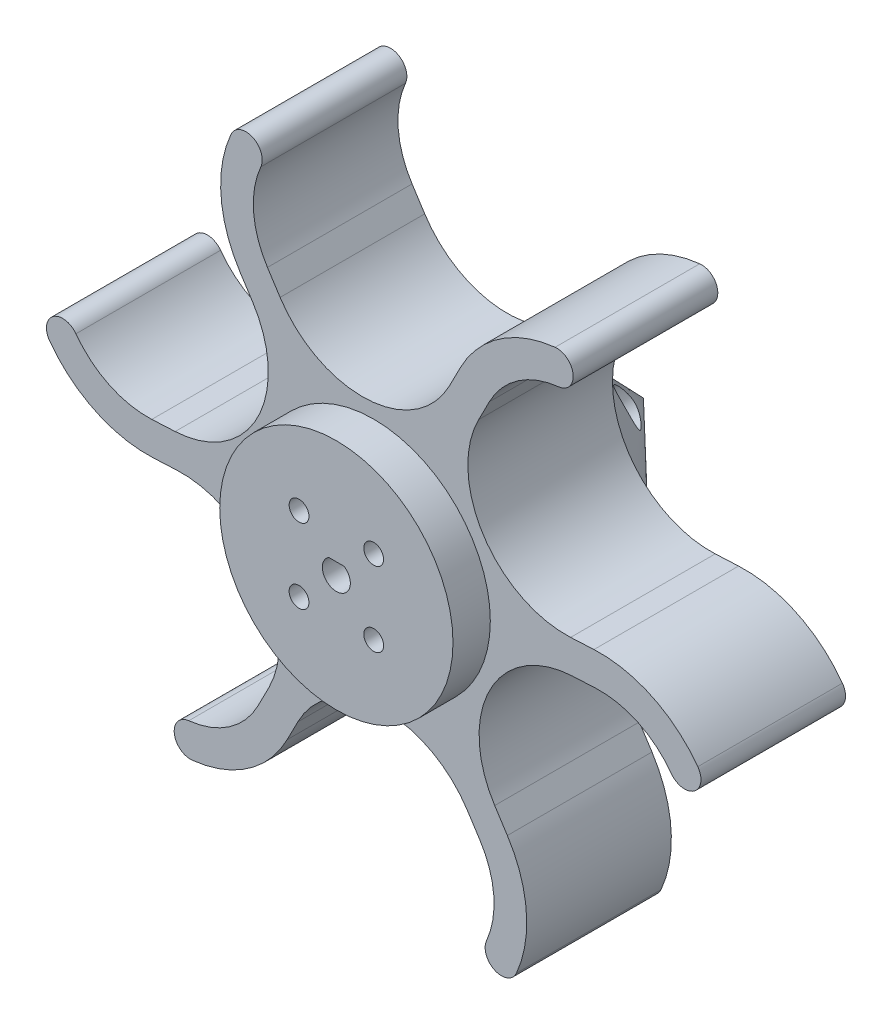
from build123d import *

# Parameters (mm, degrees)
SKETCH1_R                      = 3.5
BOSS_EXTRUDE1_DEPTH            = 21
SKETCH4_R                      = 25
BOSS_EXTRUDE2_DEPTH            = 18
CUT_EXTRUDE2_DEPTH             = 20
SKETCH7_R                      = 2.125
CUT_EXTRUDE3_DEPTH             = 105.070425208
SKETCH9_R                      = 4
CUT_EXTRUDE4_DEPTH             = 36
CUT_EXTRUDE4_DIRECTION_2_REACH = 91.556
SKETCH10_R                     = 2.125
BOSS_EXTRUDE3_DEPTH            = 10
BOSS_EXTRUDE4_DEPTH            = 31
CUT_EXTRUDE5_DEPTH             = 31
CIRPATTERN1_COUNT              = 6


with BuildPart() as part:
    # Sketch1 → Boss-Extrude1 (new body)
    with BuildSketch(Plane.XY):
        with BuildLine():
            ThreePointArc((-27.16441994, 47.550254291), (-29.67571676, 44.192804958), (-33.605829095, 45.653385243))
            Line((-33.605829095, 45.653385243), (-25.93972411, 33.765821671))
            ThreePointArc((-25.93972411, 33.765821671), (-24.90753088, 12.791204222), (-42.555985811, 1.409989939))
            Line((-42.555985811, 1.409989939), (-56.683970347, 0.71473006))
            ThreePointArc((-56.683970347, 0.71473006), (-54.098653318, -0.246072778), (-53.011938142, -2.781039515))
            ThreePointArc((-53.011938142, -2.781039515), (-53.976971405, -5.194324339), (-56.339905937, -6.27680909))
            Line((-56.339905937, -6.27680909), (-42.211921401, -5.581549211))
            ThreePointArc((-42.211921401, -5.581549211), (-23.531273241, -15.174952377), (-22.499080012, -36.149569826))
            Line((-22.499080012, -36.149569826), (-28.960959562, -48.732393278))
            ThreePointArc((-28.960959562, -48.732393278), (-25.025035607, -46.929305801), (-22.347518202, -50.331293805))
            ThreePointArc((-22.347518202, -50.331293805), (-22.445530198, -51.153776401), (-22.734076842, -51.930194333))
            Line((-22.734076842, -51.930194333), (-16.272197292, -39.347370882))
            ThreePointArc((-16.272197292, -39.347370882), (1.376257639, -27.966156599), (20.0569058, -37.559559765))
            Line((20.0569058, -37.559559765), (27.723010785, -49.447123338))
            ThreePointArc((27.723010785, -49.447123338), (28.767550893, -44.608845135), (33.605829095, -45.653385243))
            Line((33.605829095, -45.653385243), (25.93972411, -33.765821671))
            ThreePointArc((25.93972411, -33.765821671), (24.90753088, -12.791204222), (42.555985811, -1.409989939))
            Line((42.555985811, -1.409989939), (56.683970347, -0.71473006))
            ThreePointArc((56.683970347, -0.71473006), (53.016168567, 2.60900731), (56.339905937, 6.27680909))
            Line((56.339905937, 6.27680909), (42.211921401, 5.581549211))
            ThreePointArc((42.211921401, 5.581549211), (23.531273241, 15.174952377), (22.499080012, 36.149569826))
            Line((22.499080012, 36.149569826), (28.960959562, 48.732393278))
            ThreePointArc((28.960959562, 48.732393278), (24.248617674, 47.217852445), (22.734076842, 51.930194333))
            Line((22.734076842, 51.930194333), (16.272197292, 39.347370882))
            ThreePointArc((16.272197292, 39.347370882), (-1.376257639, 27.966156599), (-20.0569058, 37.559559765))
            Line((-20.0569058, 37.559559765), (-27.723010785, 49.447123338))
            ThreePointArc((-27.723010785, 49.447123338), (-27.306970607, 48.538957471), (-27.16441994, 47.550254291))
        make_face()
        with Locations((-56.511938142, -2.781039515)):
            Circle(SKETCH1_R)
        with Locations((-30.66441994, 47.550254291)):
            Circle(SKETCH1_R)
        with Locations((25.847518202, 50.331293805)):
            Circle(SKETCH1_R)
        with Locations((56.511938142, 2.781039515)):
            Circle(SKETCH1_R)
        with Locations((30.66441994, -47.550254291)):
            Circle(SKETCH1_R)
        with Locations((-25.847518202, -50.331293805)):
            Circle(SKETCH1_R)
    extrude(amount=BOSS_EXTRUDE1_DEPTH)

    # Sketch3 → Revolve1 (revolve)
    with BuildSketch(Plane(origin=(0, 0, 0), x_dir=(-0.9987913071010414, -0.04915205854685543, 0), z_dir=(0.04915205854685543, -0.9987913071010414, 0)), mode=Mode.PRIVATE) as revolve1_sk:
        Polygon((0, 0), (-28, 0), (0, 26.813467396), align=None)
    revolve(revolve1_sk.sketch.rotate(Axis((0, 0, -26.813467396), (0, 0, 1)), 357.182659299), axis=Axis((0, 0, -26.813467396), (0, 0, 1)))

    # Sketch4 → Boss-Extrude2 (add)
    with BuildSketch(Plane.XY.offset(21)):
        Circle(SKETCH4_R)
    extrude(amount=BOSS_EXTRUDE2_DEPTH)

    # Sketch5 → Cut-Extrude2 (cut)
    with BuildSketch(Plane.XY.offset(39)):
        with BuildLine():
            Line((-1.658312395, 2.5), (1.658312395, 2.5))
            ThreePointArc((1.658312395, 2.5), (0, -3), (-1.658312395, 2.5))
        make_face()
    extrude(amount=-CUT_EXTRUDE2_DEPTH, mode=Mode.SUBTRACT)

    # Sketch7 → Cut-Extrude3 (cut, through all)
    with BuildSketch(Plane.XY.offset(39)):
        with Locations((-8, 8)):
            Circle(SKETCH7_R)
        with Locations(Location((8, 8, 0), (0, 0, 225))):
            Circle(SKETCH7_R)
        with Locations((8, -8)):
            Circle(SKETCH7_R)
        with Locations(Location((-8, -8, 0), (0, 0, 110.081495148))):
            Circle(SKETCH7_R)
    extrude(amount=-CUT_EXTRUDE3_DEPTH, mode=Mode.SUBTRACT)

    # Sketch9 → Cut-Extrude4 (cut)
    with BuildSketch(Plane(origin=(0, 0, 0), x_dir=(-1, 0, 0), z_dir=(0, 0, -1))):
        with Locations(Location((-8, 8, 0), (0, 0, 315))):
            Circle(SKETCH9_R)
        with Locations(Location((8, 8, 0), (0, 0, 225))):
            Circle(SKETCH9_R)
        with Locations(Location((8, -8, 0), (0, 0, 135))):
            Circle(SKETCH9_R)
        with Locations(Location((-8, -8, 0), (0, 0, 45))):
            Circle(SKETCH9_R)
    extrude(amount=-CUT_EXTRUDE4_DEPTH, mode=Mode.SUBTRACT)

    # Cut-Extrude4 direction 2: up to this cone (the profile starts inside it)
    cut_extrude4_direction_2_end = Plane(origin=(0, 0, 0), z_dir=(0, 0, 1)).offset(-26.813466396) * Cone(1.044e-06, 153.368642194, 146.869466396, align=(Align.CENTER, Align.CENTER, Align.MIN), mode=Mode.PRIVATE)
    # Sketch9 → Cut-Extrude4 direction 2 (cut, up to the surface)
    with BuildSketch(Plane(origin=(0, 0, 0), x_dir=(-1, 0, 0), z_dir=(0, 0, -1)), mode=Mode.PRIVATE) as cut_extrude4_direction_2_sk1:
        with Locations(Location((-8, 8, 0), (0, 0, 315))):
            Circle(SKETCH9_R)
    cut_extrude4_direction_2_tool1 = extrude(cut_extrude4_direction_2_sk1.sketch, amount=CUT_EXTRUDE4_DIRECTION_2_REACH, mode=Mode.PRIVATE) & cut_extrude4_direction_2_end
    add(cut_extrude4_direction_2_tool1.solids().sort_by_distance((8, 8, 0))[0], mode=Mode.SUBTRACT)
    # Sketch9 → Cut-Extrude4 direction 2 (cut, up to the surface)
    with BuildSketch(Plane(origin=(0, 0, 0), x_dir=(-1, 0, 0), z_dir=(0, 0, -1)), mode=Mode.PRIVATE) as cut_extrude4_direction_2_sk2:
        with Locations(Location((8, 8, 0), (0, 0, 225))):
            Circle(SKETCH9_R)
    cut_extrude4_direction_2_tool2 = extrude(cut_extrude4_direction_2_sk2.sketch, amount=CUT_EXTRUDE4_DIRECTION_2_REACH, mode=Mode.PRIVATE) & cut_extrude4_direction_2_end
    add(cut_extrude4_direction_2_tool2.solids().sort_by_distance((-8, 8, 0))[0], mode=Mode.SUBTRACT)
    # Sketch9 → Cut-Extrude4 direction 2 (cut, up to the surface)
    with BuildSketch(Plane(origin=(0, 0, 0), x_dir=(-1, 0, 0), z_dir=(0, 0, -1)), mode=Mode.PRIVATE) as cut_extrude4_direction_2_sk3:
        with Locations(Location((8, -8, 0), (0, 0, 135))):
            Circle(SKETCH9_R)
    cut_extrude4_direction_2_tool3 = extrude(cut_extrude4_direction_2_sk3.sketch, amount=CUT_EXTRUDE4_DIRECTION_2_REACH, mode=Mode.PRIVATE) & cut_extrude4_direction_2_end
    add(cut_extrude4_direction_2_tool3.solids().sort_by_distance((-8, -8, 0))[0], mode=Mode.SUBTRACT)
    # Sketch9 → Cut-Extrude4 direction 2 (cut, up to the surface)
    with BuildSketch(Plane(origin=(0, 0, 0), x_dir=(-1, 0, 0), z_dir=(0, 0, -1)), mode=Mode.PRIVATE) as cut_extrude4_direction_2_sk4:
        with Locations(Location((-8, -8, 0), (0, 0, 45))):
            Circle(SKETCH9_R)
    cut_extrude4_direction_2_tool4 = extrude(cut_extrude4_direction_2_sk4.sketch, amount=CUT_EXTRUDE4_DIRECTION_2_REACH, mode=Mode.PRIVATE) & cut_extrude4_direction_2_end
    add(cut_extrude4_direction_2_tool4.solids().sort_by_distance((8, -8, 0))[0], mode=Mode.SUBTRACT)

    # Sketch10 → Boss-Extrude3 (add)
    with BuildSketch(Plane.XY.offset(21)):
        with BuildLine():
            Line((-22.499080012, -36.149569826), (-28.960959562, -48.732393278))
            ThreePointArc((-28.960959562, -48.732393278), (-27.44641873, -53.444735165), (-22.734076842, -51.930194333))
            Line((-22.734076842, -51.930194333), (-16.272197292, -39.347370882))
            ThreePointArc((-16.272197292, -39.347370882), (1.376257639, -27.966156599), (20.0569058, -37.559559765))
            Line((20.0569058, -37.559559765), (27.723010785, -49.447123338))
            ThreePointArc((27.723010785, -49.447123338), (32.561288987, -50.491663446), (33.605829095, -45.653385243))
            Line((33.605829095, -45.653385243), (25.93972411, -33.765821671))
            ThreePointArc((25.93972411, -33.765821671), (24.90753088, -12.791204222), (42.555985811, -1.409989939))
            Line((42.555985811, -1.409989939), (56.683970347, -0.71473006))
            ThreePointArc((56.683970347, -0.71473006), (60.007707717, 2.95307172), (56.339905937, 6.27680909))
            Line((56.339905937, 6.27680909), (42.211921401, 5.581549211))
            ThreePointArc((42.211921401, 5.581549211), (23.531273241, 15.174952377), (22.499080012, 36.149569826))
            Line((22.499080012, 36.149569826), (28.960959562, 48.732393278))
            ThreePointArc((28.960959562, 48.732393278), (27.44641873, 53.444735165), (22.734076842, 51.930194333))
            Line((22.734076842, 51.930194333), (16.272197292, 39.347370882))
            ThreePointArc((16.272197292, 39.347370882), (-1.376257639, 27.966156599), (-20.0569058, 37.559559765))
            Line((-20.0569058, 37.559559765), (-27.723010785, 49.447123338))
            ThreePointArc((-27.723010785, 49.447123338), (-32.561288987, 50.491663446), (-33.605829095, 45.653385243))
            Line((-33.605829095, 45.653385243), (-25.93972411, 33.765821671))
            ThreePointArc((-25.93972411, 33.765821671), (-24.90753088, 12.791204222), (-42.555985811, 1.409989939))
            Line((-42.555985811, 1.409989939), (-56.683970347, 0.71473006))
            ThreePointArc((-56.683970347, 0.71473006), (-60.007707717, -2.95307172), (-56.339905937, -6.27680909))
            Line((-56.339905937, -6.27680909), (-42.211921401, -5.581549211))
            ThreePointArc((-42.211921401, -5.581549211), (-23.531273241, -15.174952377), (-22.499080012, -36.149569826))
        make_face()
        with Locations((8, -8)):
            Circle(SKETCH10_R, mode=Mode.SUBTRACT)
        with Locations((-8, -8)):
            Circle(SKETCH10_R, mode=Mode.SUBTRACT)
        with Locations((8, 8)):
            Circle(SKETCH10_R, mode=Mode.SUBTRACT)
        with Locations((-8, 8)):
            Circle(SKETCH10_R, mode=Mode.SUBTRACT)
        with BuildLine():
            Line((-1.658312395, 2.5), (1.658312395, 2.5))
            ThreePointArc((1.658312395, 2.5), (0, -3), (-1.658312395, 2.5))
        make_face(mode=Mode.SUBTRACT)
    extrude(amount=BOSS_EXTRUDE3_DEPTH)

    # Sketch11 → Boss-Extrude4 (add)
    with BuildSketch(Plane(origin=(0, 0, 0), x_dir=(-1, 0, 0), z_dir=(0, 0, -1))):
        with BuildLine():
            ThreePointArc((-56.683970347, -0.71473006), (-59.179797072, 0.515531022), (-59.989385948, 3.177721703))
            ThreePointArc((-59.989385948, 3.177721703), (-65.212482263, -0.232315592), (-69.473061677, -4.788251558))
            ThreePointArc((-69.473061677, -4.788251558), (-68.715113625, -9.679623017), (-63.823742166, -8.921674965))
            ThreePointArc((-63.823742166, -8.921674965), (-56.668229623, -2.99119989), (-47.555985811, -1.163932238))
            Line((-47.555985811, -1.163932238), (-56.683970347, -0.71473006))
        make_face()
    boss_extrude4 = extrude(amount=-BOSS_EXTRUDE4_DEPTH)

    # Sketch12 → Cut-Extrude5 (cut)
    with BuildSketch(Plane(origin=(0, 0, 0), x_dir=(-1, 0, 0), z_dir=(0, 0, -1))):
        with BuildLine():
            ThreePointArc((-59.989385948, 3.177721703), (-59.262119459, 4.945872701), (-57.714227041, 6.068059655))
            ThreePointArc((-57.714227041, 6.068059655), (-64.679465666, 1.815993509), (-69.473061677, -4.788251558))
            ThreePointArc((-69.473061677, -4.788251558), (-65.212482263, -0.232315592), (-59.989385948, 3.177721703))
        make_face()
        with BuildLine():
            ThreePointArc((-54.040738916, 5.25958231), (-55.095832327, 5.981765108), (-56.339905937, 6.27680909))
            ThreePointArc((-56.339905937, 6.27680909), (-57.037534275, 6.241350007), (-57.714227041, 6.068059655))
            ThreePointArc((-57.714227041, 6.068059655), (-59.262119459, 4.945872701), (-59.989385948, 3.177721703))
            ThreePointArc((-59.989385948, 3.177721703), (-57.07837642, 4.399563526), (-54.040738916, 5.25958231))
        make_face()
        with BuildLine():
            Line((-47.211921401, 5.827606912), (-56.339905937, 6.27680909))
            ThreePointArc((-56.339905937, 6.27680909), (-55.095832327, 5.981765108), (-54.040738916, 5.25958231))
            ThreePointArc((-54.040738916, 5.25958231), (-50.645125248, 5.769550021), (-47.211921401, 5.827606912))
        make_face()
        with BuildLine():
            ThreePointArc((-57.714227041, 6.068059655), (-57.037534275, 6.241350007), (-56.339905937, 6.27680909))
            Line((-56.339905937, 6.27680909), (-47.211921401, 5.827606912))
            Line((-47.211921401, 5.827606912), (-42.211921401, 5.581549211))
            ThreePointArc((-42.211921401, 5.581549211), (-49.91603587, 7.323647673), (-57.714227041, 6.068059655))
        make_face()
    cut_extrude5 = extrude(amount=-CUT_EXTRUDE5_DEPTH, mode=Mode.SUBTRACT)

    # CirPattern1: Boss-Extrude4, Cut-Extrude5 ×6 about axis
    cirpattern1_axis = Axis((0, 0, 0), (0, 0, 1))
    add([boss_extrude4.rotate(cirpattern1_axis, i * 360 / CIRPATTERN1_COUNT) for i in range(1, CIRPATTERN1_COUNT)])
    add([cut_extrude5.rotate(cirpattern1_axis, i * 360 / CIRPATTERN1_COUNT) for i in range(1, CIRPATTERN1_COUNT)], mode=Mode.SUBTRACT)


solid = part.part
